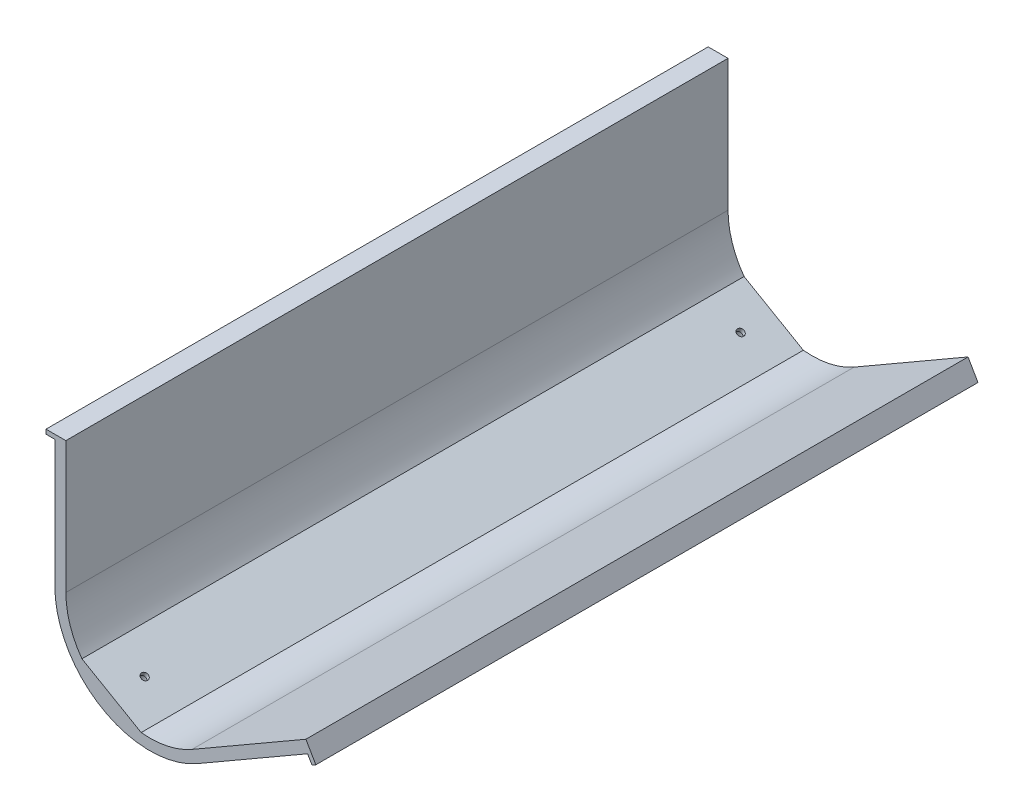
from build123d import *

# Parameters (mm, degrees)
BOSS_EXTRUDE1_DEPTH = 300
SKETCH3_R           = 1.6
CUT_EXTRUDE1_DEPTH  = 331.850051567
CUT_EXTRUDE2_START  = -2
SKETCH4_R           = 2.875
CUT_EXTRUDE2_DEPTH  = 329.850051657


with BuildPart() as part:
    # Sketch2 → Boss-Extrude1 (new body)
    with BuildSketch(Plane.XY):
        with BuildLine():
            Line((-10, 0), (-10, 57.592991829))
            Line((-10, 57.592991829), (-14, 57.592991829))
            Line((-14, 57.592991829), (-14, 59.592991829))
            Line((-14, 59.592991829), (-10, 59.592991829))
            Line((-10, 59.592991829), (-5, 59.592991829))
            Line((-5, 59.592991829), (-5, 0))
            ThreePointArc((-5, 0), (-3.13691529, -11.76748288), (2.270101024, -22.383928263))
            Line((2.270101024, -22.383928263), (29.120915128, -37.886253013))
            ThreePointArc((29.120915128, -37.886253013), (41.018534684, -37.260643809), (52.141016151, -32.990381057))
            Line((52.141016151, -32.990381057), (103.750060963, -3.193885142))
            Line((103.750060963, -3.193885142), (106.250060963, -7.524012161))
            Line((106.250060963, -7.524012161), (108.250060963, -10.988113776))
            Line((108.250060963, -10.988113776), (106.518010155, -11.988113776))
            Line((106.518010155, -11.988113776), (104.518010155, -8.524012161))
            Line((104.518010155, -8.524012161), (54.641016151, -37.320508076))
            ThreePointArc((54.641016151, -37.320508076), (11.547005384, -37.320508076), (-10, 0))
        make_face()
    extrude(amount=BOSS_EXTRUDE1_DEPTH)

    # Sketch3 → Cut-Extrude1 (cut, through all)
    with BuildSketch(Plane(origin=(-9.125, -15.804963619, 0), x_dir=(0.8660254037844395, -0.49999999999999856, 0), z_dir=(0.49999999999999856, 0.8660254037844395, 0))):
        with Locations(Location((28.660254038, -15, 0), (0, 0, 180))):
            Circle(SKETCH3_R)
        with Locations(Location((28.660254038, -285, 0), (0, 0, 180))):
            Circle(SKETCH3_R)
    extrude(amount=-CUT_EXTRUDE1_DEPTH, mode=Mode.SUBTRACT)

    # Sketch4 → Cut-Extrude2 (cut, through all)
    with BuildSketch(Plane(origin=(-9.125, -15.804963619, 0), x_dir=(0.8660254037844395, -0.49999999999999856, 0), z_dir=(0.49999999999999856, 0.8660254037844395, 0)).offset(CUT_EXTRUDE2_START)):
        with Locations(Location((28.660254038, -15, 0), (0, 0, 180))):
            Circle(SKETCH4_R)
        with Locations(Location((28.660254038, -285, 0), (0, 0, 180))):
            Circle(SKETCH4_R)
    extrude(amount=-CUT_EXTRUDE2_DEPTH, mode=Mode.SUBTRACT)


solid = part.part
